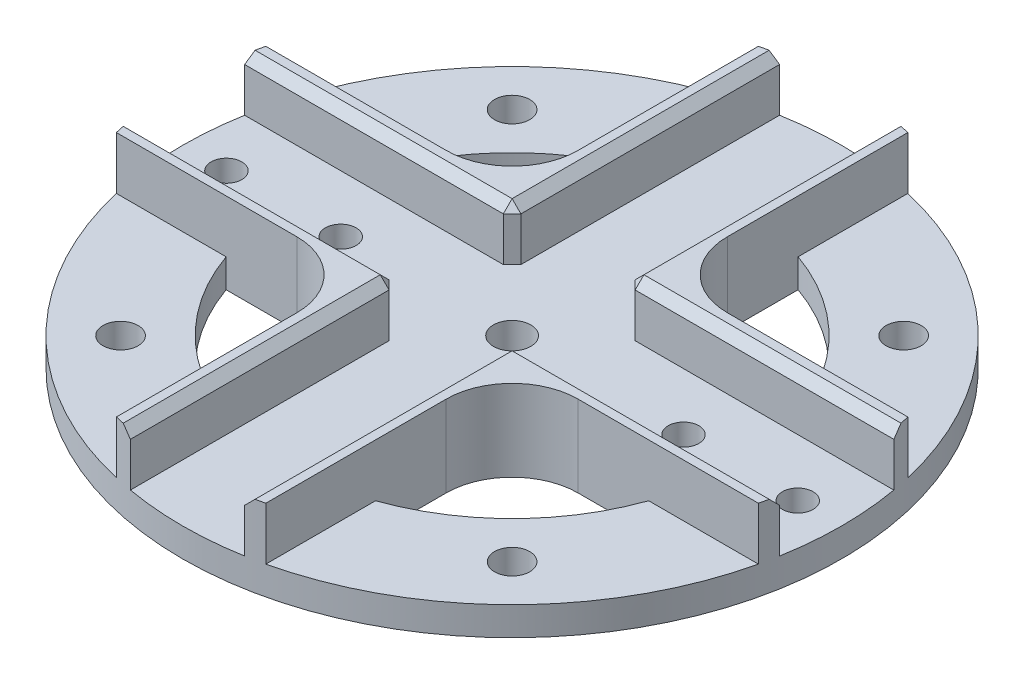
from build123d import *

# Parameters (mm, degrees)
SKETCH1_R           = 75
SKETCH1_R_2         = 4.25
BOSS_EXTRUDE1_DEPTH = 6.5
BOSS_EXTRUDE2_DEPTH = 12
CHAMFER1_SIZE       = 2
CUT_EXTRUDE1_START  = -6.5
CUT_EXTRUDE1_DEPTH  = 6.5
SKETCH5_R           = 3.5
CUT_EXTRUDE3_DEPTH  = 6.5
SKETCH4_R           = 4
CUT_EXTRUDE5_DEPTH  = 6.5


with BuildPart() as part:
    # Sketch1 → Boss-Extrude1 (new body)
    with BuildSketch(Plane(origin=(0, 0, 0), x_dir=(1, 0, 0), z_dir=(0, 1, 0))):
        with Locations(Location((0, 0, 0), (0, 0, 90))):
            Circle(SKETCH1_R)
        with Locations(Location((0, 0, 0), (0, 0, 90))):
            Circle(SKETCH1_R_2, mode=Mode.SUBTRACT)
    extrude(amount=BOSS_EXTRUDE1_DEPTH)

    # Sketch2 → Boss-Extrude2 (add)
    with BuildSketch(Plane(origin=(0, 6.5, 0), x_dir=(1, 0, 0), z_dir=(0, 1, 0))):
        with BuildLine():
            Line((-13, -13), (-73.86474125, -13))
            ThreePointArc((-73.86474125, -13), (-73.483557376, -15.005558816), (-73.047929471, -17))
            Line((-73.047929471, -17), (-32, -17))
            ThreePointArc((-32, -17), (-21.393398282, -21.393398282), (-17, -32))
            Line((-17, -32), (-17, -73.047929471))
            ThreePointArc((-17, -73.047929471), (-15.005558816, -73.483557376), (-13, -73.86474125))
            Line((-13, -73.86474125), (-13, -13))
        make_face()
        with BuildLine():
            Line((-32, 17), (-73.047929471, 17))
            ThreePointArc((-73.047929471, 17), (-73.483557376, 15.005558816), (-73.86474125, 13))
            Line((-73.86474125, 13), (-13, 13))
            Line((-13, 13), (-13, 73.86474125))
            ThreePointArc((-13, 73.86474125), (-15.005558816, 73.483557376), (-17, 73.047929471))
            Line((-17, 73.047929471), (-17, 32))
            ThreePointArc((-17, 32), (-21.393398282, 21.393398282), (-32, 17))
        make_face()
        with BuildLine():
            Line((17, 32), (17, 73.047929471))
            ThreePointArc((17, 73.047929471), (15.005558816, 73.483557376), (13, 73.86474125))
            Line((13, 73.86474125), (13, 13))
            Line((13, 13), (73.86474125, 13))
            ThreePointArc((73.86474125, 13), (73.483557376, 15.005558816), (73.047929471, 17))
            Line((73.047929471, 17), (32, 17))
            ThreePointArc((32, 17), (21.393398282, 21.393398282), (17, 32))
        make_face()
        with BuildLine():
            Line((32, -17), (73.047929471, -17))
            ThreePointArc((73.047929471, -17), (73.483557376, -15.005558816), (73.86474125, -13))
            Line((73.86474125, -13), (13, -13))
            Line((13, -13), (13, -73.86474125))
            ThreePointArc((13, -73.86474125), (15.005558816, -73.483557376), (17, -73.047929471))
            Line((17, -73.047929471), (17, -32))
            ThreePointArc((17, -32), (21.393398282, -21.393398282), (32, -17))
        make_face()
    extrude(amount=BOSS_EXTRUDE2_DEPTH)

    # Chamfer1
    chamfer1_edges = [part.edges().sort_by_distance(p)[0] for p in [
        (-13, 12.5, 13),
        (-13, 18.5, 43.432370625),
        (-43.432370625, 18.5, 13),
        (13, 12.5, 13),
        (43.432370625, 18.5, 13),
        (13, 18.5, 43.432370625),
        (-13, 12.5, -13),
        (-43.432370625, 18.5, -13),
        (-13, 18.5, -43.432370625),
        (13, 12.5, -13),
        (13, 18.5, -43.432370625),
        (43.432370625, 18.5, -13),
    ]]
    chamfer(chamfer1_edges, length=CHAMFER1_SIZE)

    # Sketch3 → Cut-Extrude1 (cut)
    with BuildSketch(Plane(origin=(0, 6.5, 0), x_dir=(1, 0, 0), z_dir=(0, 1, 0)).offset(CUT_EXTRUDE1_START)):
        with BuildLine():
            Line((32, -17), (48.083261121, -17))
            ThreePointArc((48.083261121, -17), (36.062445841, -36.062445841), (17, -48.083261121))
            Line((17, -48.083261121), (17, -32))
            ThreePointArc((17, -32), (21.393398282, -21.393398282), (32, -17))
        make_face()
        with BuildLine():
            Line((-17, -32), (-17, -48.083261121))
            ThreePointArc((-17, -48.083261121), (-36.062445841, -36.062445841), (-48.083261121, -17))
            Line((-48.083261121, -17), (-32, -17))
            ThreePointArc((-32, -17), (-21.393398282, -21.393398282), (-17, -32))
        make_face()
        with BuildLine():
            Line((17, 32), (17, 48.083261121))
            ThreePointArc((17, 48.083261121), (36.062445841, 36.062445841), (48.083261121, 17))
            Line((48.083261121, 17), (32, 17))
            ThreePointArc((32, 17), (21.393398282, 21.393398282), (17, 32))
        make_face()
        with BuildLine():
            Line((-32, 17), (-48.083261121, 17))
            ThreePointArc((-48.083261121, 17), (-36.062445841, 36.062445841), (-17, 48.083261121))
            Line((-17, 48.083261121), (-17, 32))
            ThreePointArc((-17, 32), (-21.393398282, 21.393398282), (-32, 17))
        make_face()
    extrude(amount=CUT_EXTRUDE1_DEPTH, mode=Mode.SUBTRACT)

    # Sketch5 → Cut-Extrude3 (cut)
    with BuildSketch(Plane(origin=(0, 6.5, 0), x_dir=(1, 0, 0), z_dir=(0, 1, 0))):
        with Locations(Location((65, 0, 0), (0, 0, 270))):
            Circle(SKETCH5_R)
        with Locations(Location((39, 0, 0), (0, 0, 270))):
            Circle(SKETCH5_R)
        with Locations(Location((-39, 0, 0), (0, 0, 270))):
            Circle(SKETCH5_R)
        with Locations(Location((-65, 0, 0), (0, 0, 270))):
            Circle(SKETCH5_R)
    extrude(amount=-CUT_EXTRUDE3_DEPTH, mode=Mode.SUBTRACT)

    # Sketch4 → Cut-Extrude5 (cut)
    with BuildSketch(Plane(origin=(0, 6.5, 0), x_dir=(1, 0, 0), z_dir=(0, 1, 0))):
        with Locations(Location((44.547727215, -44.547727215, 0), (0, 0, 270))):
            Circle(SKETCH4_R)
        with Locations(Location((-44.547727215, -44.547727215, 0), (0, 0, 270))):
            Circle(SKETCH4_R)
        with Locations(Location((44.547727215, 44.547727215, 0), (0, 0, 270))):
            Circle(SKETCH4_R)
        with Locations(Location((-44.547727215, 44.547727215, 0), (0, 0, 270))):
            Circle(SKETCH4_R)
    extrude(amount=-CUT_EXTRUDE5_DEPTH, mode=Mode.SUBTRACT)


solid = part.part
